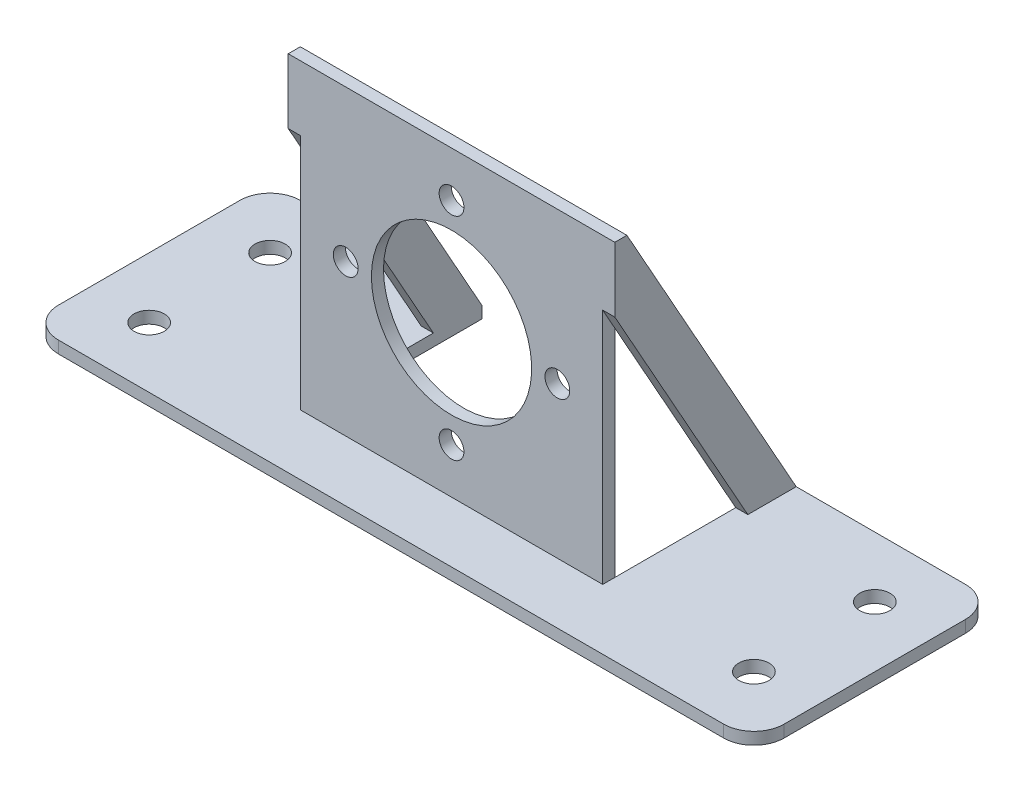
from build123d import *

# Parameters (mm, degrees)
SKETCH1_R           = 2.5
BOSS_EXTRUDE1_DEPTH = 2
SKETCH2_W           = 50
SKETCH2_H           = 52
SKETCH2_R           = 13.25
SKETCH2_R_2         = 2.05
BOSS_EXTRUDE2_DEPTH = 2
BOSS_EXTRUDE3_DEPTH = 2
BOSS_EXTRUDE4_DEPTH = 2
FILLET1_R           = 5


with BuildPart() as part:
    # Sketch1 → Boss-Extrude1 (new body)
    with BuildSketch(Plane(origin=(0, 0, 0), x_dir=(1, 0, 0), z_dir=(0, 1, 0))):
        Polygon((35, 40), (35, 10), (85, 10), (85, 40), (120, 40), (120, 0), (0, 0), (0, 40), align=None)
        with Locations(Location((10, 30, 0), (0, 0, 270))):
            Circle(SKETCH1_R, mode=Mode.SUBTRACT)
        with Locations(Location((10, 10, 0), (0, 0, 270))):
            Circle(SKETCH1_R, mode=Mode.SUBTRACT)
        with Locations(Location((110, 10, 0), (0, 0, 90))):
            Circle(SKETCH1_R, mode=Mode.SUBTRACT)
        with Locations(Location((110, 30, 0), (0, 0, 90))):
            Circle(SKETCH1_R, mode=Mode.SUBTRACT)
    extrude(amount=BOSS_EXTRUDE1_DEPTH)

    # Sketch2 → Boss-Extrude2 (add)
    with BuildSketch(Plane(origin=(0, 0, -10), x_dir=(-1, 0, 0), z_dir=(0, 0, -1))):
        with Locations((-60, 26)):
            Rectangle(SKETCH2_W, SKETCH2_H)
        with Locations((-60, 27)):
            Circle(SKETCH2_R, mode=Mode.SUBTRACT)
        with Locations((-60, 44.5)):
            Circle(SKETCH2_R_2, mode=Mode.SUBTRACT)
        with Locations((-42.5, 27)):
            Circle(SKETCH2_R_2, mode=Mode.SUBTRACT)
        with Locations((-60, 9.5)):
            Circle(SKETCH2_R_2, mode=Mode.SUBTRACT)
        with Locations((-77.5, 27)):
            Circle(SKETCH2_R_2, mode=Mode.SUBTRACT)
    extrude(amount=BOSS_EXTRUDE2_DEPTH)

    # Sketch3 → Boss-Extrude3 (add)
    with BuildSketch(Plane.ZY.offset(-35)):
        Polygon((-12, 52), (-40, 2), (-32, 2), (-10, 41.285714286), (-10, 52), align=None)
    extrude(amount=BOSS_EXTRUDE3_DEPTH)

    # Sketch4 → Boss-Extrude4 (add)
    with BuildSketch(Plane(origin=(85, 0, 0), x_dir=(0, 0, -1), z_dir=(1, 0, 0))):
        Polygon((10, 52), (10, 41.285714286), (32, 2), (40, 2), (12, 52), align=None)
    extrude(amount=BOSS_EXTRUDE4_DEPTH)

    # Fillet1
    fillet1_edges = [part.edges().sort_by_distance(p)[0] for p in [
        (0, 1, -40),
        (120, 1, -40),
        (120, 1, 0),
        (0, 1, 0),
    ]]
    fillet(fillet1_edges, radius=FILLET1_R)


solid = part.part
